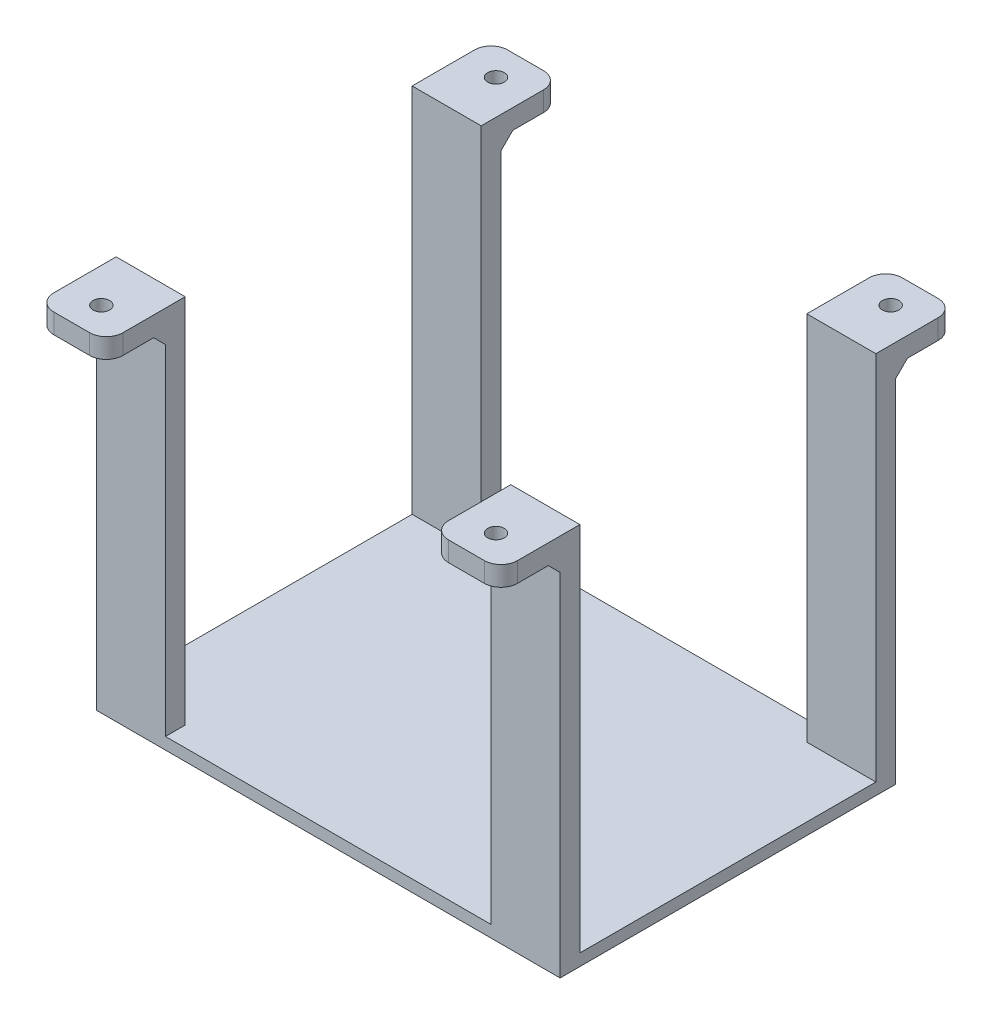
from build123d import *

# Parameters (mm, degrees)
SKETCH1_W           = 117.5
SKETCH1_H           = 85
BOSS_EXTRUDE1_DEPTH = 3
SKETCH2_W           = 17.5
SKETCH2_H           = 5
BOSS_EXTRUDE2_DEPTH = 94
SKETCH3_W           = 17.5
SKETCH3_H           = 20
SKETCH3_R           = 2.1
BOSS_EXTRUDE3_DEPTH = 5
CHAMFER1_SIZE       = 2
CHAMFER2_SIZE       = 3
FILLET1_R           = 4.2


with BuildPart() as part:
    # Sketch1 → Boss-Extrude1 (new body)
    with BuildSketch(Plane(origin=(0, 0, 0), x_dir=(1, 0, 0), z_dir=(0, 1, 0))):
        Rectangle(SKETCH1_W, SKETCH1_H)
    extrude(amount=BOSS_EXTRUDE1_DEPTH)

    # Sketch2 → Boss-Extrude2 (add)
    with BuildSketch(Plane(origin=(0, 3, 0), x_dir=(1, 0, 0), z_dir=(0, 1, 0))):
        with Locations((-50, 40)):
            Rectangle(SKETCH2_W, SKETCH2_H)
        with Locations((50, 40)):
            Rectangle(SKETCH2_W, SKETCH2_H)
        with Locations((50, -40)):
            Rectangle(SKETCH2_W, SKETCH2_H)
        with Locations((-50, -40)):
            Rectangle(SKETCH2_W, SKETCH2_H)
    extrude(amount=BOSS_EXTRUDE2_DEPTH)

    # Sketch3 → Boss-Extrude3 (add)
    # profile 1 of 4: a face of its own
    with BuildSketch(Plane(origin=(0, 97, 0), x_dir=(1, 0, 0), z_dir=(0, 1, 0))):
        with Locations((-50, 47.5)):
            Rectangle(SKETCH3_W, SKETCH3_H)
        with Locations(Location((-50, 50, 0), (0, 0, 270))):
            Circle(SKETCH3_R, mode=Mode.SUBTRACT)
    # profile 2 of 4: a face of its own
    with BuildSketch(Plane(origin=(0, 97, 0), x_dir=(1, 0, 0), z_dir=(0, 1, 0))):
        with Locations((50, 47.5)):
            Rectangle(SKETCH3_W, SKETCH3_H)
        with Locations(Location((50, 50, 0), (0, 0, 90))):
            Circle(SKETCH3_R, mode=Mode.SUBTRACT)
    # profile 3 of 4: a face of its own
    with BuildSketch(Plane(origin=(0, 97, 0), x_dir=(1, 0, 0), z_dir=(0, 1, 0))):
        with Locations((50, -47.5)):
            Rectangle(SKETCH3_W, SKETCH3_H)
        with Locations(Location((50, -50, 0), (0, 0, 270))):
            Circle(SKETCH3_R, mode=Mode.SUBTRACT)
    # profile 4 of 4: a face of its own
    with BuildSketch(Plane(origin=(0, 97, 0), x_dir=(1, 0, 0), z_dir=(0, 1, 0))):
        with Locations((-50, -47.5)):
            Rectangle(SKETCH3_W, SKETCH3_H)
        with Locations(Location((-50, -50, 0), (0, 0, 90))):
            Circle(SKETCH3_R, mode=Mode.SUBTRACT)
    extrude(amount=-BOSS_EXTRUDE3_DEPTH)

    # Chamfer1
    chamfer1_edges = [part.edges().sort_by_distance(p)[0] for p in [
        (50, 92, 47.9),
        (-50, 92, 52.1),
        (-50, 92, -52.1),
        (50, 92, -47.9),
    ]]
    chamfer(chamfer1_edges, length=CHAMFER1_SIZE)

    # Chamfer2
    chamfer2_edges = [part.edges().sort_by_distance(p)[0] for p in [
        (50, 92, 42.5),
        (-50, 92, 42.5),
        (-50, 92, -42.5),
        (50, 92, -42.5),
    ]]
    chamfer(chamfer2_edges, length=CHAMFER2_SIZE)

    # Fillet1
    fillet1_edges = [part.edges().sort_by_distance(p)[0] for p in [
        (41.25, 94.5, 57.5),
        (58.75, 94.5, 57.5),
        (-58.75, 94.5, 57.5),
        (-41.25, 94.5, 57.5),
        (-41.25, 94.5, -57.5),
        (-58.75, 94.5, -57.5),
        (58.75, 94.5, -57.5),
        (41.25, 94.5, -57.5),
    ]]
    fillet(fillet1_edges, radius=FILLET1_R)


solid = part.part
